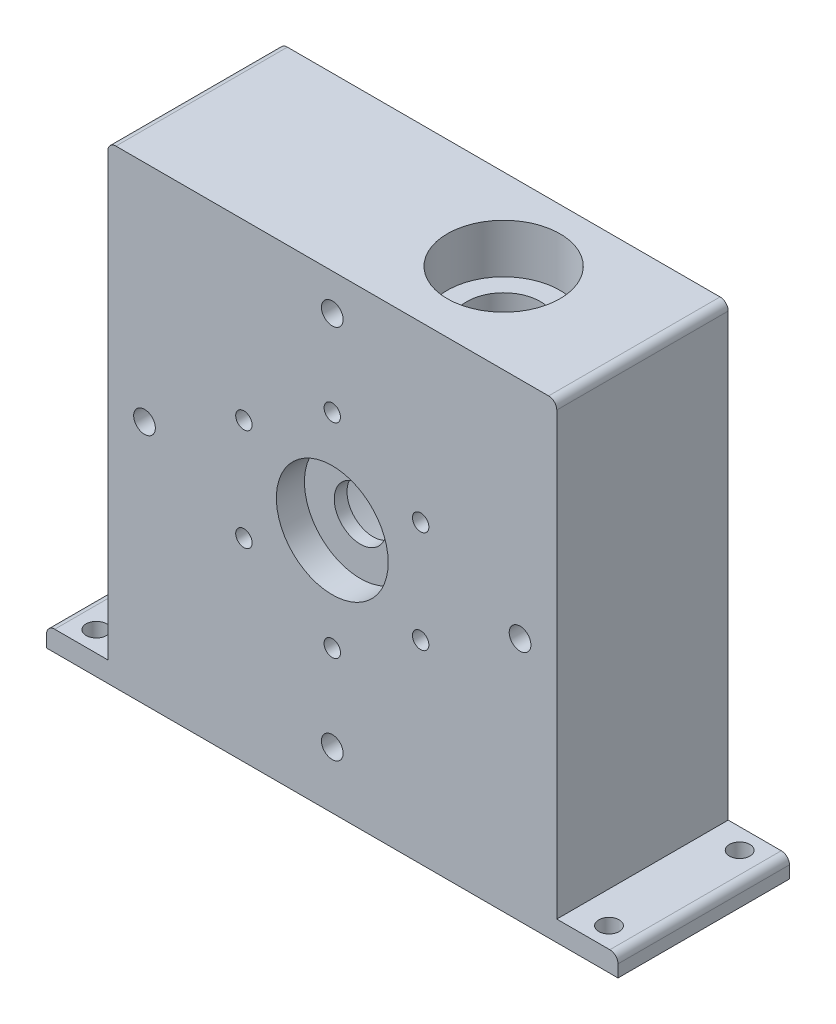
from build123d import *

# Parameters (mm, degrees)
SKETCH1_W                       = 139.7
SKETCH1_H                       = 12.7
BOSS_EXTRUDE1_DEPTH             = 146.05
SKETCH2_W                       = 12.7
SKETCH2_H                       = 6.35
BOSS_EXTRUDE2_DEPTH             = 19.05
CUT_EXTRUDE4_REACH              = 213.847
SKETCH6_R                       = 3.175
FILLET1_R                       = 2.54
SKETCH3_R                       = 17.399
CUT_EXTRUDE5_DEPTH              = 8.73125
CUT_EXTRUDE6_REACH              = 217.89
SKETCH7_R                       = 8.128
SKETCH8_R                       = 44.45
BOSS_EXTRUDE3_DEPTH             = 40.64
OUTLET_REACH                    = 224.21
OUTLET_END_RADIUS               = 44.45
SKETCH10_R                      = 11.4554
SKETCH11_R                      = 52.4383
SKETCH11_R_2                    = 50.3047
CUT_EXTRUDE9_DEPTH              = 1.3208
MIRROR3_COPY_1_REACH            = 213.847
MIRROR3_COPY_1_SKETCH_R         = 3.175
SKETCH12_R                      = 3.175
CUT_EXTRUDE10_DEPTH             = 2.54
FILLET2_R                       = 0.127
FILLET3_R                       = 0.254
SKETCH13_R                      = 3.3782
CUT_EXTRUDE11_DEPTH             = 223.210082195
SKETCH14_R                      = 17.526
CUT_EXTRUDE12_DEPTH             = 15.24
TAP_DRILL_FOR_1_4_20_TAP1_D     = 5.1054
TAP_DRILL_FOR_1_4_20_TAP1_DEPTH = 8.626183098
TAP_DRILL_FOR_1_4_20_TAP1_TIP   = 1.533816902


with BuildPart() as part:
    # Sketch1 → Boss-Extrude1 (new body)
    with BuildSketch(Plane(origin=(0, 0, 0), x_dir=(1, 0, 0), z_dir=(0, 1, 0))):
        with Locations((69.85, 6.35)):
            Rectangle(SKETCH1_W, SKETCH1_H)
    extrude(amount=BOSS_EXTRUDE1_DEPTH)

    # Sketch2 → Boss-Extrude2 (add)
    with BuildSketch(Plane.ZY):
        with Locations((-6.35, 3.175)):
            Rectangle(SKETCH2_W, SKETCH2_H)
    boss_extrude2 = extrude(amount=BOSS_EXTRUDE2_DEPTH)

    # Mirror1: Boss-Extrude2 across plane
    add(boss_extrude2.mirror(Plane.ZY.offset(-69.85)))

    # Sketch6 → Cut-Extrude4 (cut, up to next)
    with BuildSketch(Plane(origin=(0, 6.35, 0), x_dir=(1, 0, 0), z_dir=(0, 1, 0)), mode=Mode.PRIVATE) as cut_extrude4_sk1:
        with Locations(Location((-9.906, 6.35, 0), (0, 0, 270))):
            Circle(SKETCH6_R)
    cut_extrude4_tool1 = extrude(cut_extrude4_sk1.sketch, amount=-CUT_EXTRUDE4_REACH, mode=Mode.PRIVATE) & part.part
    cut_extrude4 = cut_extrude4_tool1.solids().sort_by_distance((-9.906, 6.35, -6.35))[0]
    add(cut_extrude4, mode=Mode.SUBTRACT)

    # Mirror2: Cut-Extrude4 across plane
    add(cut_extrude4.mirror(Plane.ZY.offset(-69.85)), mode=Mode.SUBTRACT)

    # Fillet1
    fillet1_edges = [part.edges().sort_by_distance(p)[0] for p in [
        (139.7, 146.05, -6.35),
        (-19.05, 6.35, -6.35),
        (158.75, 6.35, -6.35),
        (0, 146.05, -6.35),
    ]]
    fillet(fillet1_edges, radius=FILLET1_R)

    # Sketch3 → Cut-Extrude5 (cut)
    with BuildSketch(Plane.XY):
        with Locations((69.85, 76.2)):
            Circle(SKETCH3_R)
    extrude(amount=-CUT_EXTRUDE5_DEPTH, mode=Mode.SUBTRACT)

    # Sketch7 → Cut-Extrude6 (cut, up to next)
    with BuildSketch(Plane.XY.offset(-8.73125), mode=Mode.PRIVATE) as cut_extrude6_sk1:
        with Locations((69.85, 76.2)):
            Circle(SKETCH7_R)
    cut_extrude6_tool1 = extrude(cut_extrude6_sk1.sketch, amount=-CUT_EXTRUDE6_REACH, mode=Mode.PRIVATE) & part.part
    add(cut_extrude6_tool1.solids().sort_by_distance((69.85, 76.2, -8.73125))[0], mode=Mode.SUBTRACT)

    # Sketch8 → Boss-Extrude3 (add)
    with BuildSketch(Plane(origin=(0, 0, -12.7), x_dir=(-1, 0, 0), z_dir=(0, 0, -1))):
        with BuildLine():
            Line((-137.16, 146.05), (-2.54, 146.05))
            ThreePointArc((-2.54, 146.05), (-0.743948776, 145.306051224), (0, 143.51))
            Line((0, 143.51), (0, 6.35))
            Line((0, 6.35), (16.51, 6.35))
            ThreePointArc((16.51, 6.35), (18.306051224, 5.606051224), (19.05, 3.81))
            Line((19.05, 3.81), (19.05, 0))
            Line((19.05, 0), (-158.75, 0))
            Line((-158.75, 0), (-158.75, 3.81))
            ThreePointArc((-158.75, 3.81), (-158.006051224, 5.606051224), (-156.21, 6.35))
            Line((-156.21, 6.35), (-139.7, 6.35))
            Line((-139.7, 6.35), (-139.7, 143.51))
            ThreePointArc((-139.7, 143.51), (-138.956051224, 145.306051224), (-137.16, 146.05))
        make_face()
        with Locations((-69.85, 76.2)):
            Circle(SKETCH8_R, mode=Mode.SUBTRACT)
    extrude(amount=BOSS_EXTRUDE3_DEPTH)

    # Outlet: up to this cylinder (the profile starts outside it)
    outlet_end = Plane(origin=(69.85, 76.2, -27.94), z_dir=(0, 0, 1)) * Cylinder(OUTLET_END_RADIUS, 538.32, mode=Mode.PRIVATE)
    # Sketch10 → Outlet (cut, up to the surface)
    with BuildSketch(Plane(origin=(0, 146.05, 0), x_dir=(1, 0, 0), z_dir=(0, 1, 0)), mode=Mode.PRIVATE) as outlet_sk1:
        with Locations(Location((95.2246, 27.94, 0), (0, 0, 270))):
            Circle(SKETCH10_R)
    outlet_tool1 = extrude(outlet_sk1.sketch, amount=-OUTLET_REACH, mode=Mode.PRIVATE) - outlet_end
    add(outlet_tool1.solids().sort_by_distance((95.2246, 146.05, -27.94))[0], mode=Mode.SUBTRACT)

    # Sketch11 → Cut-Extrude9 (cut)
    with BuildSketch(Plane(origin=(0, 0, -53.34), x_dir=(-1, 0, 0), z_dir=(0, 0, -1))):
        with Locations((-69.85, 76.2)):
            Circle(SKETCH11_R)
        with Locations((-69.85, 76.2)):
            Circle(SKETCH11_R_2, mode=Mode.SUBTRACT)
    extrude(amount=-CUT_EXTRUDE9_DEPTH, mode=Mode.SUBTRACT)

    # Mirror3: Cut-Extrude4 across plane
    add(cut_extrude4.mirror(Plane(origin=(0, 0, -26.67), x_dir=(1, 0, 0), z_dir=(0, 0, -1))), mode=Mode.SUBTRACT)

    # Mirror3 copy 1 sketch → Mirror3 copy 1 (cut, up to next)
    with BuildSketch(Plane(origin=(139.7, 6.35, -53.34), x_dir=(-1, 0, 0), z_dir=(0, 1, 0)), mode=Mode.PRIVATE) as mirror3_copy_1_sk1:
        with Locations(Location((-9.906, 6.35, 0), (0, 0, 270))):
            Circle(MIRROR3_COPY_1_SKETCH_R)
    mirror3_copy_1_tool1 = extrude(mirror3_copy_1_sk1.sketch, amount=-MIRROR3_COPY_1_REACH, mode=Mode.PRIVATE) & part.part
    add(mirror3_copy_1_tool1.solids().sort_by_distance((149.606, 6.35, -46.99))[0], mode=Mode.SUBTRACT)

    # Sketch12 → Cut-Extrude10 (cut)
    with BuildSketch(Plane(origin=(0, 0, -12.7), x_dir=(-1, 0, 0), z_dir=(0, 0, -1))):
        with Locations((-88.9, 95.25)):
            Circle(SKETCH12_R)
        with Locations((-50.8, 95.25)):
            Circle(SKETCH12_R)
        with Locations((-50.8, 57.15)):
            Circle(SKETCH12_R)
        with Locations((-88.9, 57.15)):
            Circle(SKETCH12_R)
    extrude(amount=-CUT_EXTRUDE10_DEPTH, mode=Mode.SUBTRACT)

    # Fillet2
    fillet2_edges = [part.edges().sort_by_distance(p)[0] for p in [
        (122.2883, 76.2, -53.34),
        (120.1547, 76.2, -53.34),
    ]]
    fillet(fillet2_edges, radius=FILLET2_R)

    # Fillet3
    fillet3_edges = [part.edges().sort_by_distance(p)[0] for p in [
        (122.2883, 76.2, -52.0192),
        (120.1547, 76.2, -52.0192),
    ]]
    fillet(fillet3_edges, radius=FILLET3_R)

    # Sketch13 → Cut-Extrude11 (cut, through all)
    with BuildSketch(Plane(origin=(0, 0, -53.34), x_dir=(-1, 0, 0), z_dir=(0, 0, -1))):
        with Locations((-128.27, 76.2)):
            Circle(SKETCH13_R)
        with Locations((-69.85, 134.62)):
            Circle(SKETCH13_R)
        with Locations((-11.43, 76.2)):
            Circle(SKETCH13_R)
        with Locations((-69.85, 17.78)):
            Circle(SKETCH13_R)
    extrude(amount=-CUT_EXTRUDE11_DEPTH, mode=Mode.SUBTRACT)

    # Sketch14 → Cut-Extrude12 (cut)
    with BuildSketch(Plane(origin=(0, 146.05, 0), x_dir=(1, 0, 0), z_dir=(0, 1, 0))):
        with Locations(Location((95.2246, 27.94, 0), (0, 0, 270))):
            Circle(SKETCH14_R)
    extrude(amount=-CUT_EXTRUDE12_DEPTH, mode=Mode.SUBTRACT)

    # Tap Drill for 1/4-20 Tap1
    with Locations(Plane(origin=(69.85, 107.95, 0), x_dir=(1, 0, 0), z_dir=(0, 0, 1))):
        with Locations((0, 0), (27.49630657, -15.875), (27.49630657, -47.625), (0, -63.5), (-27.49630657, -47.625), (-27.49630657, -15.875)):
            Hole(TAP_DRILL_FOR_1_4_20_TAP1_D / 2, depth=TAP_DRILL_FOR_1_4_20_TAP1_DEPTH)
            with Locations((0, 0, -(TAP_DRILL_FOR_1_4_20_TAP1_DEPTH + TAP_DRILL_FOR_1_4_20_TAP1_TIP / 2))):  # 118° drill point
                Cone(0, TAP_DRILL_FOR_1_4_20_TAP1_D / 2, TAP_DRILL_FOR_1_4_20_TAP1_TIP, mode=Mode.SUBTRACT)


solid = part.part
